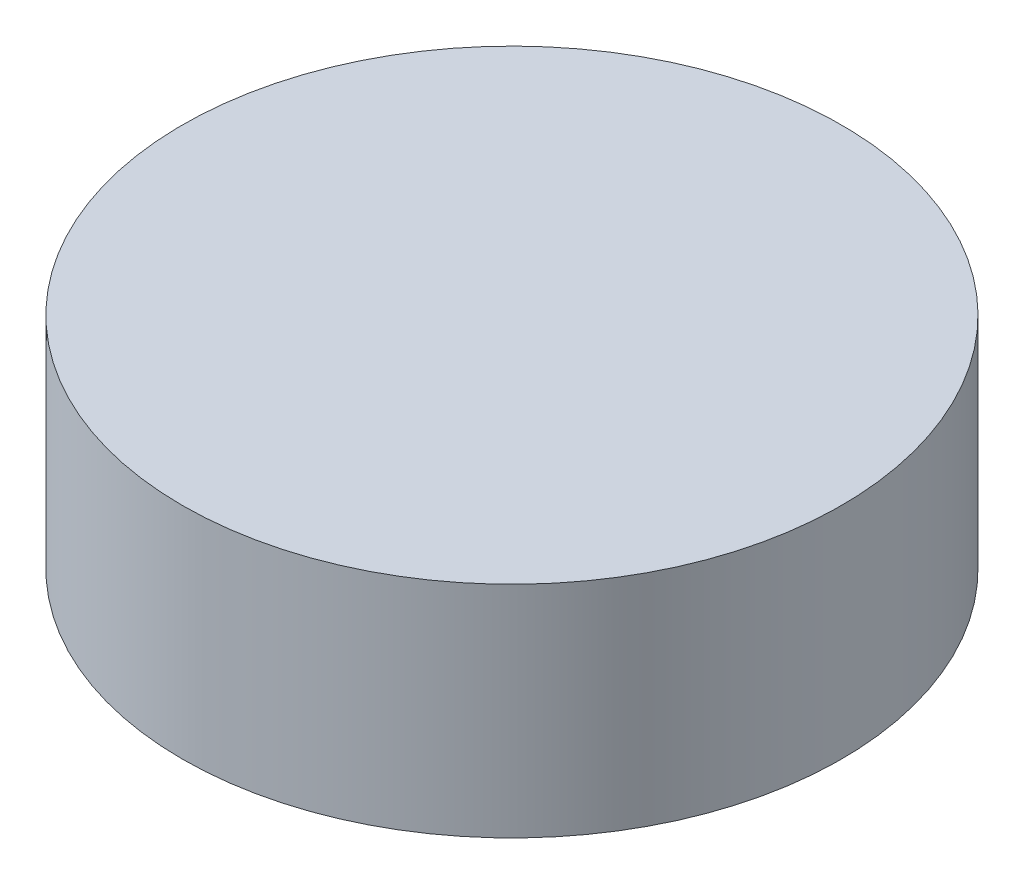
from build123d import *

# Parameters (mm, degrees)
SKETCH1_R           = 60
BOSS_EXTRUDE1_DEPTH = 40


with BuildPart() as part:
    # Sketch1 → Boss-Extrude1 (new body)
    with BuildSketch(Plane(origin=(0, 0, 0), x_dir=(1, 0, 0), z_dir=(0, 1, 0))):
        with Locations(Location((0, 0, 0), (0, 0, 270))):
            Circle(SKETCH1_R)
    extrude(amount=BOSS_EXTRUDE1_DEPTH)


solid = part.part
